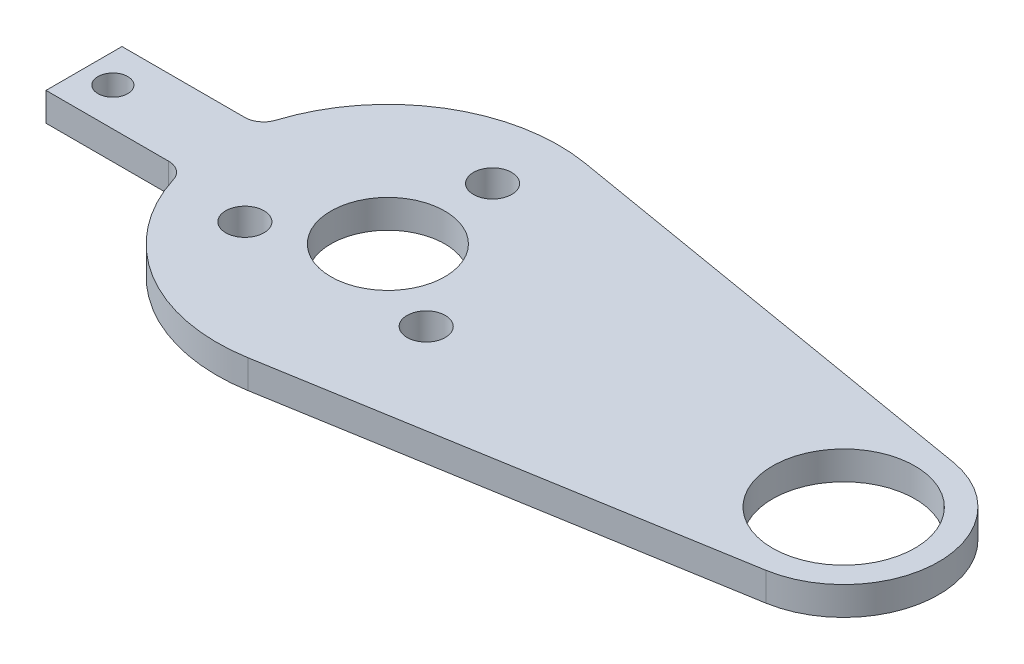
from build123d import *

# Parameters (mm, degrees)
BOSS_EXTRUDE1_DEPTH        = 4.7625
SKETCH2_R                  = 11.90625
CUT_EXTRUDE1_DEPTH         = 97.524699721
M6_CLEARANCE_HOLE1_D       = 6.4
SKETCH5_R                  = 9.525
CUT_EXTRUDE2_DEPTH         = 97.524699721
FILLET1_R                  = 3.175
F_10_CLEARANCE_HOLE1_D     = 4.9784
F_10_CLEARANCE_HOLE1_DEPTH = 9.525
F_10_CLEARANCE_HOLE1_TIP   = 1.495662253


with BuildPart() as part:
    # Sketch1 → Boss-Extrude1 (new body)
    with BuildSketch(Plane(origin=(0, 0, 0), x_dir=(1, 0, 0), z_dir=(0, 1, 0))):
        with BuildLine():
            Line((4.7625, 28.175329967), (78.845833333, 15.652961093))
            ThreePointArc((78.845833333, 15.652961093), (92.075, 0), (78.845833333, -15.652961093))
            Line((78.845833333, -15.652961093), (4.7625, -28.175329967))
            ThreePointArc((4.7625, -28.175329967), (-15.889172282, -23.750049035), (-27.86051193, -6.35))
            Line((-27.86051193, -6.35), (-50.8, -6.35))
            Line((-50.8, -6.35), (-50.8, 6.35))
            Line((-50.8, 6.35), (-27.86051193, 6.35))
            ThreePointArc((-27.86051193, 6.35), (-15.889172282, 23.750049035), (4.7625, 28.175329967))
        make_face()
    extrude(amount=BOSS_EXTRUDE1_DEPTH)

    # Sketch2 → Cut-Extrude1 (cut, through all)
    with BuildSketch(Plane(origin=(0, 4.7625, 0), x_dir=(1, 0, 0), z_dir=(0, 1, 0))):
        with Locations(Location((76.2, 0, 0), (0, 0, 270))):
            Circle(SKETCH2_R)
    extrude(amount=-CUT_EXTRUDE1_DEPTH, mode=Mode.SUBTRACT)

    # M6 Clearance Hole1 (through all)
    with Locations(Plane(origin=(0, 4.7625, -17.5), x_dir=(0, 0, 1), z_dir=(0, 1, 0))):
        with Locations((0, 0), (26.25, -15.155444566), (26.25, 15.155444566)):
            Hole(M6_CLEARANCE_HOLE1_D / 2)

    # Sketch5 → Cut-Extrude2 (cut, through all)
    with BuildSketch(Plane(origin=(0, 4.7625, 0), x_dir=(1, 0, 0), z_dir=(0, 1, 0))):
        with Locations(Location((0, 0, 0), (0, 0, 270))):
            Circle(SKETCH5_R)
    extrude(amount=-CUT_EXTRUDE2_DEPTH, mode=Mode.SUBTRACT)

    # Fillet1
    fillet1_edges = [part.edges().sort_by_distance(p)[0] for p in [
        (-27.86051193, 2.38125, 6.35),
        (-27.86051193, 2.38125, -6.35),
    ]]
    fillet(fillet1_edges, radius=FILLET1_R)

    # #10 Clearance Hole1
    with Locations(Plane(origin=(-45.974, 4.7625, 0), x_dir=(0, 0, 1), z_dir=(0, 1, 0))):
        with Locations((0, 0)):
            Hole(F_10_CLEARANCE_HOLE1_D / 2, depth=F_10_CLEARANCE_HOLE1_DEPTH)
            with Locations((0, 0, -(F_10_CLEARANCE_HOLE1_DEPTH + F_10_CLEARANCE_HOLE1_TIP / 2))):  # 118° drill point
                Cone(0, F_10_CLEARANCE_HOLE1_D / 2, F_10_CLEARANCE_HOLE1_TIP, mode=Mode.SUBTRACT)


solid = part.part
